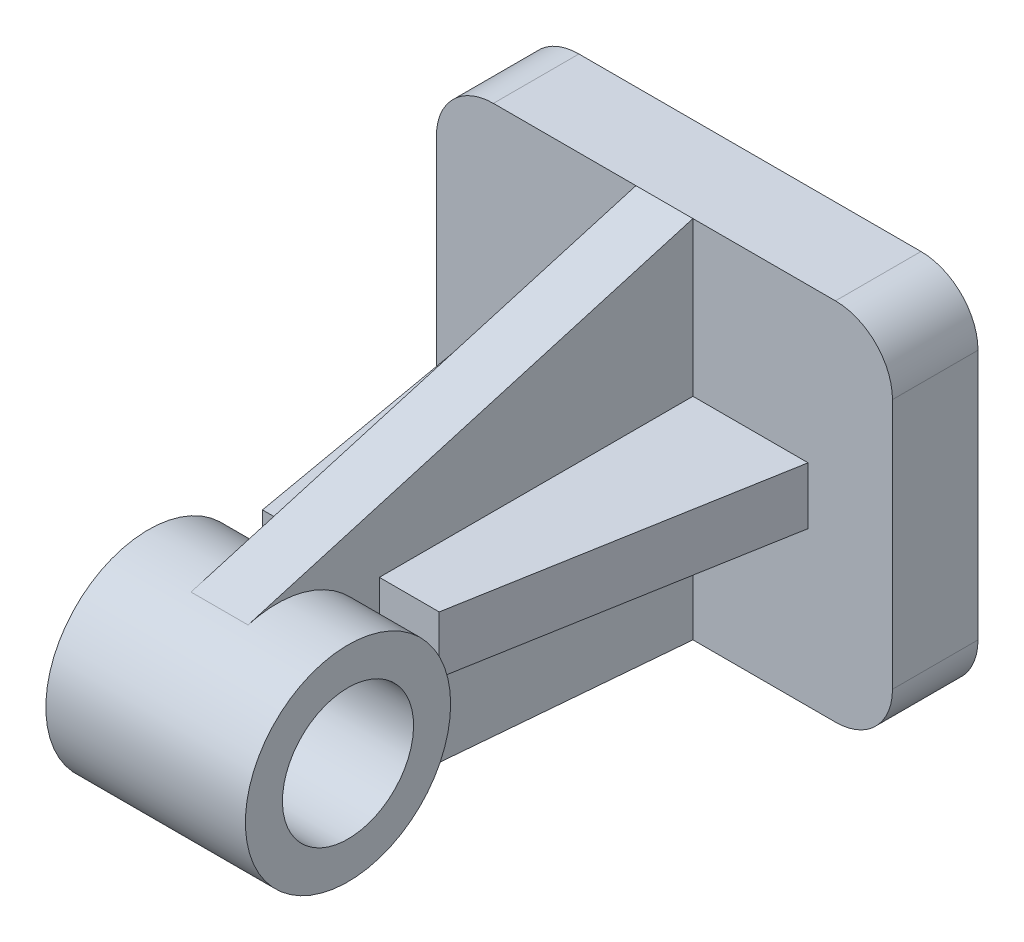
from build123d import *

# Parameters (mm, degrees)
SKETCH1_W           = 64
SKETCH1_H           = 80
BOSS_EXTRUDE1_DEPTH = 15
FILLET2_R           = 10
SKETCH2_R           = 18
SKETCH2_R_2         = 11.5
EXTRUDE_THIN1_DEPTH = 17.5
BOSS_EXTRUDE2_DEPTH = 5
BOSS_EXTRUDE3_DEPTH = 5


with BuildPart() as part:
    # Sketch1 → Boss-Extrude1 (new body)
    with BuildSketch(Plane(origin=(0, 0, 0), x_dir=(0, 1, 0), z_dir=(0, 0, 1))):
        Rectangle(SKETCH1_W, SKETCH1_H)
    extrude(amount=BOSS_EXTRUDE1_DEPTH)

    # Fillet2
    fillet2_edges = [part.edges().sort_by_distance(p)[0] for p in [
        (40, 32, 7.5),
        (40, -32, 7.5),
        (-40, -32, 7.5),
        (-40, 32, 7.5),
    ]]
    fillet(fillet2_edges, radius=FILLET2_R)



with BuildPart() as body_2:
    # Sketch2 → Extrude-Thin1 (new, symmetric)
    with BuildSketch(Plane.YZ):
        with Locations((-8, 88)):
            Circle(SKETCH2_R)
        with Locations((-8, 88)):
            Circle(SKETCH2_R_2, mode=Mode.SUBTRACT)
    extrude(amount=EXTRUDE_THIN1_DEPTH, both=True)


with BuildPart() as part_1:
    add(part.part)

    add(body_2.part)  # Boss-Extrude2 merges body 2
    # Sketch3 → Boss-Extrude2 (add, symmetric)
    with BuildSketch(Plane.YZ):
        with BuildLine():
            Line((-25.940694884, 89.459954482), (-32, 15))
            Line((-32, 15), (32, 15))
            Line((32, 15), (9.282478357, 93.03149499))
            ThreePointArc((9.282478357, 93.03149499), (9.819716755, 90.541199478), (10, 88))
            ThreePointArc((10, 88), (-8.730579254, 70.01483239), (-25.940694884, 89.459954482))
        make_face()
    extrude(amount=BOSS_EXTRUDE2_DEPTH, both=True)

    # Sketch4 → Boss-Extrude3 (add, symmetric)
    with BuildSketch(Plane(origin=(0, 0, 0), x_dir=(-1, 0, 0), z_dir=(0, 1, 0))):
        Polygon((-15.5, 70), (-25.197983939, 15), (25.197983939, 15), (15.5, 70), align=None)
    extrude(amount=BOSS_EXTRUDE3_DEPTH, both=True)


solid = part_1.part
